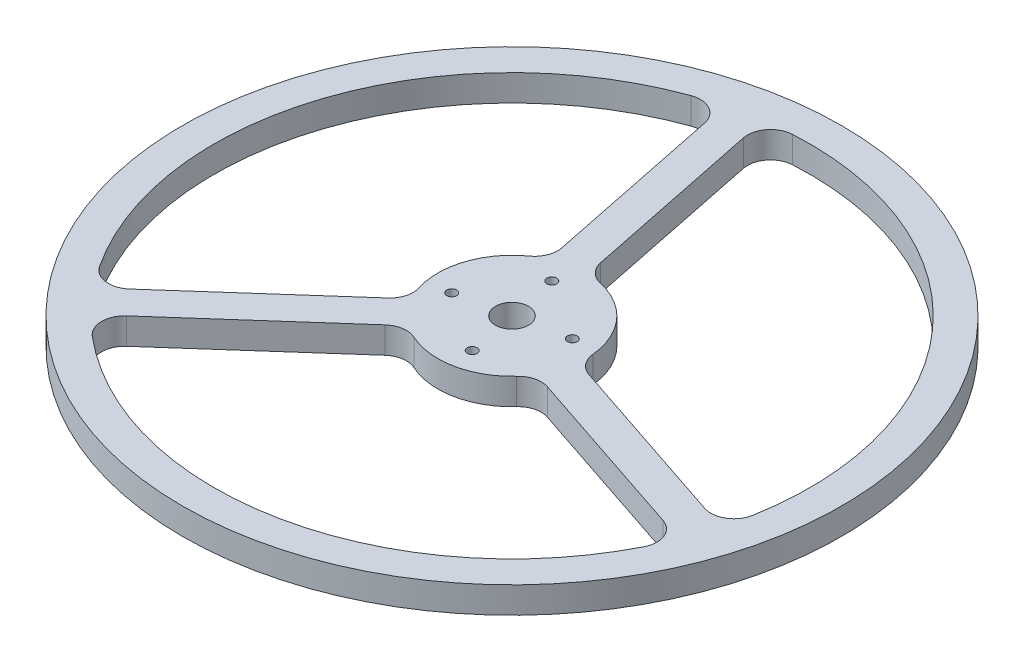
from build123d import *

# Parameters (mm, degrees)
SKETCH_1_R          = 100
EXTRUDE_2_DEPTH     = 8
SKETCH_3_R          = 5
SKETCH_3_R_2        = 1.5
CUT_EXTRUDE_1_DEPTH = 142.647449677
FILLET_1_R          = 7
FILLET_2_R          = 7


with BuildPart() as part:
    # 草图1 → 凸台-拉伸2 (new body)
    with BuildSketch(Plane(origin=(0, 0, 0), x_dir=(1, 0, 0), z_dir=(0, 1, 0))):
        with Locations(Location((0, 0, 0), (0, 0, 270))):
            Circle(SKETCH_1_R)
        with BuildLine():
            Line((-22.971939134, 87.411215106), (-9.292268133, 20.49155321))
            ThreePointArc((-9.292268133, 20.49155321), (-21.343901201, 7.119542226), (-19.733222484, -10.809714631))
            Line((-19.733222484, -10.809714631), (-70.847514199, -56.116488181))
            ThreePointArc((-70.847514199, -56.116488181), (-85.735481912, 28.5982107), (-22.971939134, 87.411215106))
        make_face(mode=Mode.SUBTRACT)
        with BuildLine():
            Line((-13.174547237, 89.413991181), (0.505123764, 22.494329285))
            ThreePointArc((0.505123764, 22.494329285), (16.837655032, 14.924589543), (22.392339709, -2.198436343))
            Line((22.392339709, -2.198436343), (87.186302424, -23.811324689))
            ThreePointArc((87.186302424, -23.811324689), (67.634517925, 59.949999991), (-13.174547237, 89.413991181))
        make_face(mode=Mode.SUBTRACT)
        with BuildLine():
            Line((19.22809872, -11.684614654), (84.022061435, -33.297503))
            ThreePointArc((84.022061435, -33.297503), (18.100963986, -88.548210691), (-64.21436329, -63.599890417))
            Line((-64.21436329, -63.599890417), (-13.100071576, -18.293116867))
            ThreePointArc((-13.100071576, -18.293116867), (4.50624617, -22.044131769), (19.22809872, -11.684614654))
        make_face(mode=Mode.SUBTRACT)
    extrude(amount=EXTRUDE_2_DEPTH)

    # 草图3 → 切除-拉伸1 (cut, through all)
    with BuildSketch(Plane(origin=(0, 8, 0), x_dir=(1, 0, 0), z_dir=(0, 1, 0))):
        with Locations(Location((0, 0, 0), (0, 0, 270))):
            Circle(SKETCH_3_R)
        with Locations(Location((-3.104302917, 15.185957441, 0), (0, 0, 270))):
            Circle(SKETCH_3_R_2)
        with Locations(Location((15.185957441, 3.104302917, 0), (0, 0, 270))):
            Circle(SKETCH_3_R_2)
        with Locations(Location((3.104302917, -15.185957441, 0), (0, 0, 270))):
            Circle(SKETCH_3_R_2)
        with Locations(Location((-15.185957441, -3.104302917, 0), (0, 0, 270))):
            Circle(SKETCH_3_R_2)
    extrude(amount=-CUT_EXTRUDE_1_DEPTH, mode=Mode.SUBTRACT)

    # 圆角1
    fillet_1_edges = [part.edges().sort_by_distance(p)[0] for p in [
        (87.186302424, 4, 23.811324689),
        (-13.174547237, 4, -89.413991181),
        (-64.21436329, 4, 63.599890417),
        (84.022061435, 4, 33.297503),
        (-22.971939134, 4, -87.411215106),
        (-70.847514199, 4, 56.116488181),
    ]]
    fillet(fillet_1_edges, radius=FILLET_1_R)

    # 圆角2
    fillet_2_edges = [part.edges().sort_by_distance(p)[0] for p in [
        (0.505123764, 4, -22.494329285),
        (22.392339709, 4, 2.198436343),
        (19.22809872, 4, 11.684614654),
        (-13.100071576, 4, 18.293116867),
        (-19.733222484, 4, 10.809714631),
        (-9.292268133, 4, -20.49155321),
    ]]
    fillet(fillet_2_edges, radius=FILLET_2_R)


solid = part.part
